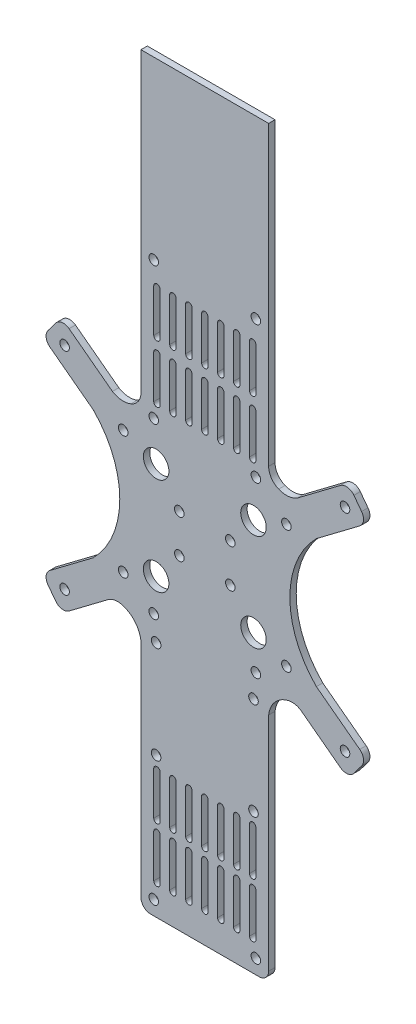
from build123d import *

# Parameters (mm, degrees)
CROQUIS1_R              = 4
CROQUIS1_R_2            = 1.5
SALIENTE_EXTRUIR1_DEPTH = 2
REDONDEO2_R             = 3
REDONDEO3_R             = 5


with BuildPart() as part:
    # Croquis1 → Saliente-Extruir1 (new body)
    with BuildSketch(Plane.XY):
        with BuildLine():
            Line((20, 125.25), (-20, 125.25))
            Line((-20, 125.25), (-20, 30.25))
            ThreePointArc((-20, 30.25), (-24.015805554, 27.30711153), (-28.936345286, 28.065778476))
            Line((-28.936345286, 28.065778476), (-44.909055487, 40.102078939))
            Line((-44.909055487, 40.102078939), (-47.918130603, 36.108901389))
            Line((-47.918130603, 36.108901389), (-50.927205719, 32.115723839))
            Line((-50.927205719, 32.115723839), (-34.954495518, 20.079423376))
            ThreePointArc((-34.954495518, 20.079423376), (-26.637326031, 0), (-34.954495518, -20.079423376))
            Line((-34.954495518, -20.079423376), (-50.927205719, -32.115723839))
            Line((-50.927205719, -32.115723839), (-47.918130603, -36.108901389))
            Line((-47.918130603, -36.108901389), (-44.909055487, -40.102078939))
            Line((-44.909055487, -40.102078939), (-28.936345286, -28.065778476))
            ThreePointArc((-28.936345286, -28.065778476), (-22.980271648, -29.80711153), (-20, -35.25))
            Line((-20, -35.25), (-20, -107.75))
            Line((-20, -107.75), (20, -107.75))
            Line((20, -107.75), (20, -35.25))
            ThreePointArc((20, -35.25), (22.980271648, -29.80711153), (28.936345286, -28.065778476))
            Line((28.936345286, -28.065778476), (44.909055487, -40.102078939))
            Line((44.909055487, -40.102078939), (47.918130603, -36.108901389))
            Line((47.918130603, -36.108901389), (50.927205719, -32.115723839))
            Line((50.927205719, -32.115723839), (34.954495518, -20.079423376))
            ThreePointArc((34.954495518, -20.079423376), (26.637326031, 0), (34.954495518, 20.079423376))
            Line((34.954495518, 20.079423376), (50.927205719, 32.115723839))
            Line((50.927205719, 32.115723839), (47.918130603, 36.108901389))
            Line((47.918130603, 36.108901389), (44.909055487, 40.102078939))
            Line((44.909055487, 40.102078939), (28.936345286, 28.065778476))
            ThreePointArc((28.936345286, 28.065778476), (24.015805554, 27.30711153), (20, 30.25))
            Line((20, 30.25), (20, 125.25))
        make_face()
        with Locations((-15.25, 15.25)):
            Circle(CROQUIS1_R, mode=Mode.SUBTRACT)
        with Locations((-15.25, -15.25)):
            Circle(CROQUIS1_R, mode=Mode.SUBTRACT)
        with Locations(Location((15.25, -15.25, 0), (0, 0, 180))):
            Circle(CROQUIS1_R, mode=Mode.SUBTRACT)
        with Locations(Location((15.25, 15.25, 0), (0, 0, 180))):
            Circle(CROQUIS1_R, mode=Mode.SUBTRACT)
        with Locations((-43.924953053, 33.099826273)):
            Circle(CROQUIS1_R_2, mode=Mode.SUBTRACT)
        with Locations((-43.924953053, -33.099826273)):
            Circle(CROQUIS1_R_2, mode=Mode.SUBTRACT)
        with Locations(Location((43.924953053, -33.099826273, 0), (0, 0, 180))):
            Circle(CROQUIS1_R_2, mode=Mode.SUBTRACT)
        with Locations(Location((43.924953053, 33.099826273, 0), (0, 0, 180))):
            Circle(CROQUIS1_R_2, mode=Mode.SUBTRACT)
        with Locations((-15.25, -33.25)):
            Circle(CROQUIS1_R_2, mode=Mode.SUBTRACT)
        with Locations((-15.25, -63.75)):
            Circle(CROQUIS1_R_2, mode=Mode.SUBTRACT)
        with Locations(Location((15.25, -63.75, 0), (0, 0, 180))):
            Circle(CROQUIS1_R_2, mode=Mode.SUBTRACT)
        with Locations(Location((15.25, -33.25, 0), (0, 0, 180))):
            Circle(CROQUIS1_R_2, mode=Mode.SUBTRACT)
        with Locations((-7.9863551, 6.018150232)):
            Circle(CROQUIS1_R_2, mode=Mode.SUBTRACT)
        with Locations((-25.560283405, 19.261055082)):
            Circle(CROQUIS1_R_2, mode=Mode.SUBTRACT)
        with Locations((-25.560283405, -19.261055082)):
            Circle(CROQUIS1_R_2, mode=Mode.SUBTRACT)
        with Locations((-7.9863551, -6.018150232)):
            Circle(CROQUIS1_R_2, mode=Mode.SUBTRACT)
        with Locations(Location((25.560283405, -19.261055082, 0), (0, 0, 180))):
            Circle(CROQUIS1_R_2, mode=Mode.SUBTRACT)
        with Locations(Location((7.9863551, -6.018150232, 0), (0, 0, 180))):
            Circle(CROQUIS1_R_2, mode=Mode.SUBTRACT)
        with Locations(Location((7.9863551, 6.018150232, 0), (0, 0, 180))):
            Circle(CROQUIS1_R_2, mode=Mode.SUBTRACT)
        with Locations(Location((25.560283405, 19.261055082, 0), (0, 0, 180))):
            Circle(CROQUIS1_R_2, mode=Mode.SUBTRACT)
        with Locations((-16, -103.25)):
            Circle(CROQUIS1_R_2, mode=Mode.SUBTRACT)
        with Locations((-16, -25.75)):
            Circle(CROQUIS1_R_2, mode=Mode.SUBTRACT)
        with Locations((-16, 27.25)):
            Circle(CROQUIS1_R_2, mode=Mode.SUBTRACT)
        with Locations((-16, 70.25)):
            Circle(CROQUIS1_R_2, mode=Mode.SUBTRACT)
        with Locations(Location((16, -103.25, 0), (0, 0, 180))):
            Circle(CROQUIS1_R_2, mode=Mode.SUBTRACT)
        with Locations(Location((16, -25.75, 0), (0, 0, 180))):
            Circle(CROQUIS1_R_2, mode=Mode.SUBTRACT)
        with Locations(Location((16, 27.25, 0), (0, 0, 180))):
            Circle(CROQUIS1_R_2, mode=Mode.SUBTRACT)
        with Locations(Location((16, 70.25, 0), (0, 0, 180))):
            Circle(CROQUIS1_R_2, mode=Mode.SUBTRACT)
        with BuildLine():
            Line((-11, -84.75), (-11, -98.25))
            ThreePointArc((-11, -98.25), (-10, -99.25), (-9, -98.25))
            Line((-9, -98.25), (-9, -84.75))
            ThreePointArc((-9, -84.75), (-10, -83.75), (-11, -84.75))
        make_face(mode=Mode.SUBTRACT)
        with BuildLine():
            Line((-16, -84.75), (-16, -98.25))
            ThreePointArc((-16, -98.25), (-15, -99.25), (-14, -98.25))
            Line((-14, -98.25), (-14, -84.75))
            ThreePointArc((-14, -84.75), (-15, -83.75), (-16, -84.75))
        make_face(mode=Mode.SUBTRACT)
        with BuildLine():
            Line((-6, -84.75), (-6, -98.25))
            ThreePointArc((-6, -98.25), (-5, -99.25), (-4, -98.25))
            Line((-4, -98.25), (-4, -84.75))
            ThreePointArc((-4, -84.75), (-5, -83.75), (-6, -84.75))
        make_face(mode=Mode.SUBTRACT)
        with BuildLine():
            Line((-1, -84.75), (-1, -98.25))
            ThreePointArc((-1, -98.25), (0, -99.25), (1, -98.25))
            Line((1, -98.25), (1, -84.75))
            ThreePointArc((1, -84.75), (0, -83.75), (-1, -84.75))
        make_face(mode=Mode.SUBTRACT)
        with BuildLine():
            Line((4, -84.75), (4, -98.25))
            ThreePointArc((4, -98.25), (5, -99.25), (6, -98.25))
            Line((6, -98.25), (6, -84.75))
            ThreePointArc((6, -84.75), (5, -83.75), (4, -84.75))
        make_face(mode=Mode.SUBTRACT)
        with BuildLine():
            Line((9, -84.75), (9, -98.25))
            ThreePointArc((9, -98.25), (10, -99.25), (11, -98.25))
            Line((11, -98.25), (11, -84.75))
            ThreePointArc((11, -84.75), (10, -83.75), (9, -84.75))
        make_face(mode=Mode.SUBTRACT)
        with BuildLine():
            Line((14, -84.75), (14, -98.25))
            ThreePointArc((14, -98.25), (15, -99.25), (16, -98.25))
            Line((16, -98.25), (16, -84.75))
            ThreePointArc((16, -84.75), (15, -83.75), (14, -84.75))
        make_face(mode=Mode.SUBTRACT)
        with BuildLine():
            Line((-11, 45.25), (-11, 31.75))
            ThreePointArc((-11, 31.75), (-10, 30.75), (-9, 31.75))
            Line((-9, 31.75), (-9, 45.25))
            ThreePointArc((-9, 45.25), (-10, 46.25), (-11, 45.25))
        make_face(mode=Mode.SUBTRACT)
        with BuildLine():
            Line((-6, 45.25), (-6, 31.75))
            ThreePointArc((-6, 31.75), (-5, 30.75), (-4, 31.75))
            Line((-4, 31.75), (-4, 45.25))
            ThreePointArc((-4, 45.25), (-5, 46.25), (-6, 45.25))
        make_face(mode=Mode.SUBTRACT)
        with BuildLine():
            Line((-1, 45.25), (-1, 31.75))
            ThreePointArc((-1, 31.75), (0, 30.75), (1, 31.75))
            Line((1, 31.75), (1, 45.25))
            ThreePointArc((1, 45.25), (0, 46.25), (-1, 45.25))
        make_face(mode=Mode.SUBTRACT)
        with BuildLine():
            Line((4, 45.25), (4, 31.75))
            ThreePointArc((4, 31.75), (5, 30.75), (6, 31.75))
            Line((6, 31.75), (6, 45.25))
            ThreePointArc((6, 45.25), (5, 46.25), (4, 45.25))
        make_face(mode=Mode.SUBTRACT)
        with BuildLine():
            Line((9, 45.25), (9, 31.75))
            ThreePointArc((9, 31.75), (10, 30.75), (11, 31.75))
            Line((11, 31.75), (11, 45.25))
            ThreePointArc((11, 45.25), (10, 46.25), (9, 45.25))
        make_face(mode=Mode.SUBTRACT)
        with BuildLine():
            Line((14, 45.25), (14, 31.75))
            ThreePointArc((14, 31.75), (15, 30.75), (16, 31.75))
            Line((16, 31.75), (16, 45.25))
            ThreePointArc((16, 45.25), (15, 46.25), (14, 45.25))
        make_face(mode=Mode.SUBTRACT)
        with BuildLine():
            Line((-16, 45.25), (-16, 31.75))
            ThreePointArc((-16, 31.75), (-15, 30.75), (-14, 31.75))
            Line((-14, 31.75), (-14, 45.25))
            ThreePointArc((-14, 45.25), (-15, 46.25), (-16, 45.25))
        make_face(mode=Mode.SUBTRACT)
        with BuildLine():
            Line((-16, 63.25), (-16, 49.75))
            ThreePointArc((-16, 49.75), (-15, 48.75), (-14, 49.75))
            Line((-14, 49.75), (-14, 63.25))
            ThreePointArc((-14, 63.25), (-15, 64.25), (-16, 63.25))
        make_face(mode=Mode.SUBTRACT)
        with BuildLine():
            Line((-11, 63.25), (-11, 49.75))
            ThreePointArc((-11, 49.75), (-10, 48.75), (-9, 49.75))
            Line((-9, 49.75), (-9, 63.25))
            ThreePointArc((-9, 63.25), (-10, 64.25), (-11, 63.25))
        make_face(mode=Mode.SUBTRACT)
        with BuildLine():
            Line((-6, 63.25), (-6, 49.75))
            ThreePointArc((-6, 49.75), (-5, 48.75), (-4, 49.75))
            Line((-4, 49.75), (-4, 63.25))
            ThreePointArc((-4, 63.25), (-5, 64.25), (-6, 63.25))
        make_face(mode=Mode.SUBTRACT)
        with BuildLine():
            Line((4, 63.25), (4, 49.75))
            ThreePointArc((4, 49.75), (5, 48.75), (6, 49.75))
            Line((6, 49.75), (6, 63.25))
            ThreePointArc((6, 63.25), (5, 64.25), (4, 63.25))
        make_face(mode=Mode.SUBTRACT)
        with BuildLine():
            Line((9, 63.25), (9, 49.75))
            ThreePointArc((9, 49.75), (10, 48.75), (11, 49.75))
            Line((11, 49.75), (11, 63.25))
            ThreePointArc((11, 63.25), (10, 64.25), (9, 63.25))
        make_face(mode=Mode.SUBTRACT)
        with BuildLine():
            Line((14, 63.25), (14, 49.75))
            ThreePointArc((14, 49.75), (15, 48.75), (16, 49.75))
            Line((16, 49.75), (16, 63.25))
            ThreePointArc((16, 63.25), (15, 64.25), (14, 63.25))
        make_face(mode=Mode.SUBTRACT)
        with BuildLine():
            Line((-1, 63.25), (-1, 49.75))
            ThreePointArc((-1, 49.75), (0, 48.75), (1, 49.75))
            Line((1, 49.75), (1, 63.25))
            ThreePointArc((1, 63.25), (0, 64.25), (-1, 63.25))
        make_face(mode=Mode.SUBTRACT)
        with BuildLine():
            Line((-16, -67.75), (-16, -81.25))
            ThreePointArc((-16, -81.25), (-15, -82.25), (-14, -81.25))
            Line((-14, -81.25), (-14, -67.75))
            ThreePointArc((-14, -67.75), (-15, -66.75), (-16, -67.75))
        make_face(mode=Mode.SUBTRACT)
        with BuildLine():
            Line((-11, -67.75), (-11, -81.25))
            ThreePointArc((-11, -81.25), (-10, -82.25), (-9, -81.25))
            Line((-9, -81.25), (-9, -67.75))
            ThreePointArc((-9, -67.75), (-10, -66.75), (-11, -67.75))
        make_face(mode=Mode.SUBTRACT)
        with BuildLine():
            Line((-6, -67.75), (-6, -81.25))
            ThreePointArc((-6, -81.25), (-5, -82.25), (-4, -81.25))
            Line((-4, -81.25), (-4, -67.75))
            ThreePointArc((-4, -67.75), (-5, -66.75), (-6, -67.75))
        make_face(mode=Mode.SUBTRACT)
        with BuildLine():
            Line((4, -67.75), (4, -81.25))
            ThreePointArc((4, -81.25), (5, -82.25), (6, -81.25))
            Line((6, -81.25), (6, -67.75))
            ThreePointArc((6, -67.75), (5, -66.75), (4, -67.75))
        make_face(mode=Mode.SUBTRACT)
        with BuildLine():
            Line((9, -67.75), (9, -81.25))
            ThreePointArc((9, -81.25), (10, -82.25), (11, -81.25))
            Line((11, -81.25), (11, -67.75))
            ThreePointArc((11, -67.75), (10, -66.75), (9, -67.75))
        make_face(mode=Mode.SUBTRACT)
        with BuildLine():
            Line((14, -67.75), (14, -81.25))
            ThreePointArc((14, -81.25), (15, -82.25), (16, -81.25))
            Line((16, -81.25), (16, -67.75))
            ThreePointArc((16, -67.75), (15, -66.75), (14, -67.75))
        make_face(mode=Mode.SUBTRACT)
        with BuildLine():
            Line((-1, -67.75), (-1, -81.25))
            ThreePointArc((-1, -81.25), (0, -82.25), (1, -81.25))
            Line((1, -81.25), (1, -67.75))
            ThreePointArc((1, -67.75), (0, -66.75), (-1, -67.75))
        make_face(mode=Mode.SUBTRACT)
    extrude(amount=SALIENTE_EXTRUIR1_DEPTH)

    # Redondeo2
    redondeo2_edges = [part.edges().sort_by_distance(p)[0] for p in [
        (44.909055487, 40.102078939, 1),
        (50.927205719, 32.115723839, 1),
        (50.927205719, -32.115723839, 1),
        (44.909055487, -40.102078939, 1),
        (20, -107.75, 1),
        (-20, -107.75, 1),
        (-44.909055487, -40.102078939, 1),
        (-50.927205719, -32.115723839, 1),
        (-50.927205719, 32.115723839, 1),
        (-44.909055487, 40.102078939, 1),
    ]]
    fillet(redondeo2_edges, radius=REDONDEO2_R)

    # Redondeo3
    redondeo3_edges = [part.edges().sort_by_distance(p)[0] for p in [
        (20, 30.25, 1),
        (28.936345286, -28.065778476, 1),
        (-28.936345286, -28.065778476, 1),
        (-20, 30.25, 1),
    ]]
    fillet(redondeo3_edges, radius=REDONDEO3_R)


solid = part.part
